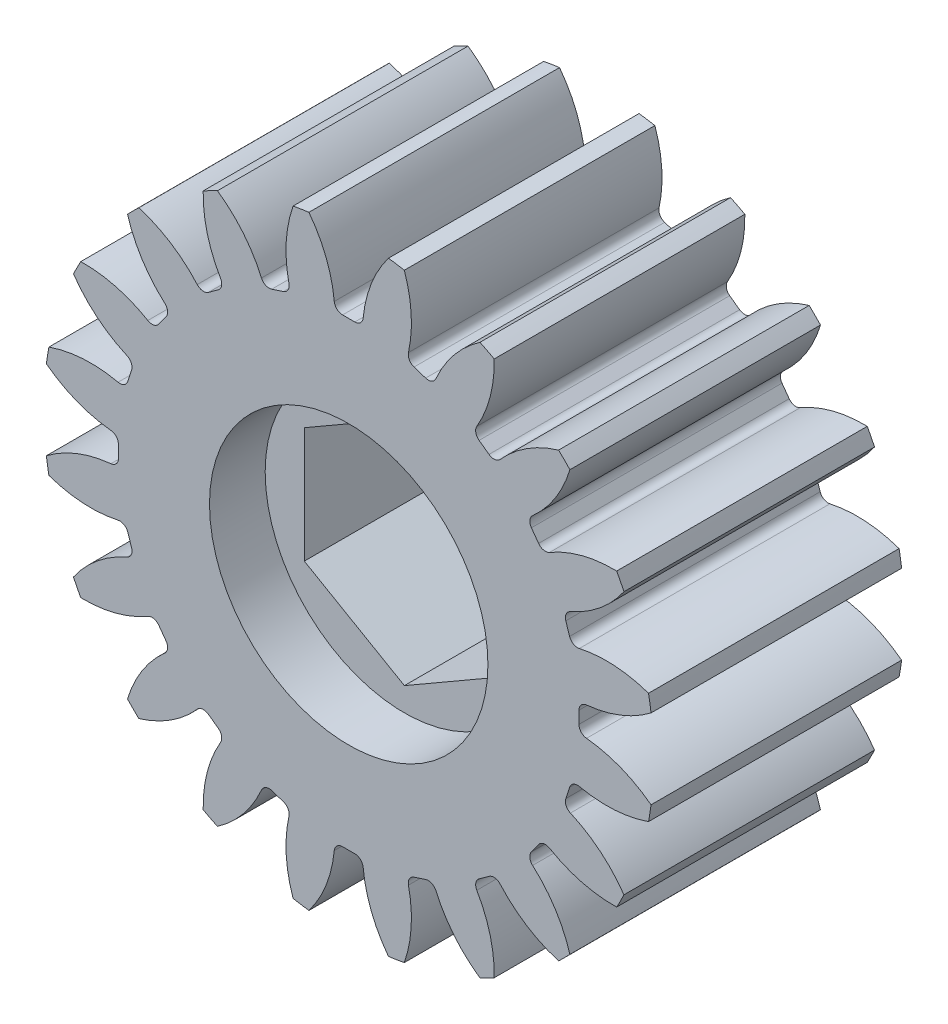
from build123d import *

# Parameters (mm, degrees)
SKIZZE1_R                       = 10.9515
AUFSATZ_LINEAR_AUSTRAGEN1_DEPTH = 4.5
SKIZZE4_R                       = 5
SKIZZE4_R_2                     = 2.5
SCHNITT_LINEAR_AUSTRAGEN2_DEPTH = 2
SCHNITT_LINEAR_AUSTRAGEN3_DEPTH = 18.912864218
KREISMUSTER1_COUNT              = 20
SKIZZE8_R                       = 6
AUFSATZ_LINEAR_AUSTRAGEN2_DEPTH = 1
SCHNITT_LINEAR_AUSTRAGEN4_DEPTH = 19.324547451


with BuildPart() as part:
    # Skizze1 → Aufsatz-Linear austragen1 (new, symmetric)
    with BuildSketch(Plane.XY):
        Circle(SKIZZE1_R)
    extrude(amount=AUFSATZ_LINEAR_AUSTRAGEN1_DEPTH, both=True)

    # Skizze4 → Schnitt-Linear austragen2 (cut)
    with BuildSketch(Plane.XY.offset(4.5)):
        Circle(SKIZZE4_R)
        Circle(SKIZZE4_R_2, mode=Mode.SUBTRACT)
    extrude(amount=-SCHNITT_LINEAR_AUSTRAGEN2_DEPTH, mode=Mode.SUBTRACT)

    # Skizze6 → Schnitt-Linear austragen3 (cut, through all)
    with BuildSketch(Plane.XY.offset(4.5)):
        with BuildLine():
            Line((-0.219874756, 8.27), (0.219874756, 8.27))
            ThreePointArc((0.219874756, 8.27), (0.421386888, 8.347754953), (0.518441911, 8.540714262))
            ThreePointArc((0.518441911, 8.540714262), (1.009154991, 10.195876188), (2.08, 11.55))
            ThreePointArc((2.08, 11.55), (0, 11.670581665), (-2.08, 11.55))
            ThreePointArc((-2.08, 11.55), (-1.009154991, 10.195876188), (-0.518441911, 8.540714262))
            ThreePointArc((-0.518441911, 8.540714262), (-0.421386888, 8.347754953), (-0.219874756, 8.27))
        make_face()
    schnitt_linear_austragen3 = extrude(amount=-SCHNITT_LINEAR_AUSTRAGEN3_DEPTH, mode=Mode.SUBTRACT)

    # Kreismuster1: Schnitt-Linear austragen3 ×20 about axis
    kreismuster1_axis = Axis((0, 0, 0), (0, 0, 1))
    for i in range(1, KREISMUSTER1_COUNT):
        add(schnitt_linear_austragen3.rotate(kreismuster1_axis, i * 360 / KREISMUSTER1_COUNT), mode=Mode.SUBTRACT)

    # Skizze8 → Aufsatz-Linear austragen2 (add)
    with BuildSketch(Plane(origin=(0, 0, -4.5), x_dir=(-1, 0, 0), z_dir=(0, 0, -1))):
        with Locations(Location((0, 0, 0), (0, 0, 180))):
            Circle(SKIZZE8_R)
    extrude(amount=AUFSATZ_LINEAR_AUSTRAGEN2_DEPTH)

    # Skizze7 → Schnitt-Linear austragen4 (cut, through all)
    with BuildSketch(Plane.XY.offset(4.5)):
        Polygon((0, 4.15), (-3.594005426, 2.075), (-3.594005426, -2.075), (0, -4.15), (3.594005426, -2.075), (3.594005426, 2.075), align=None)
    extrude(amount=-SCHNITT_LINEAR_AUSTRAGEN4_DEPTH, mode=Mode.SUBTRACT)


solid = part.part
